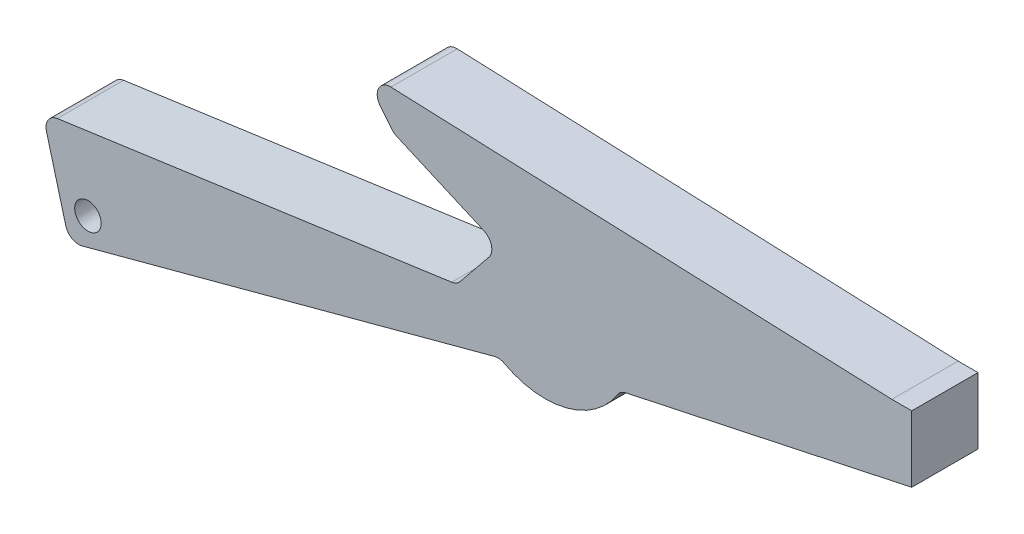
from build123d import *

# Parameters (mm, degrees)
BOSS_EXTRUDE1_DEPTH = 10
SKETCH2_R           = 2
CUT_EXTRUDE1_DEPTH  = 116.971936943
FILLET1_R           = 2


with BuildPart() as part:
    # Sketch1 → Boss-Extrude1 (new body)
    with BuildSketch(Plane(origin=(0, 0, 0), x_dir=(0, 1, 0), z_dir=(0, 0, 1))):
        with BuildLine():
            Line((-36.324229872, 27.68131099), (-51.324229872, 23.662073103))
            Line((-51.324229872, 23.662073103), (-33.907532364, -41.337926897))
            ThreePointArc((-33.907532364, -41.337926897), (-35.409341514, -51.440004773), (-29.149202114, -59.509581147))
            Line((-29.149202114, -59.509581147), (-19.739589339, -103.514798876))
            Line((-19.739589339, -103.514798876), (-9.739589339, -103.514798876))
            Line((-9.739589339, -103.514798876), (-9.739589339, -100.514798876))
            Line((-9.739589339, -100.514798876), (-6.545356821, -20.514798876))
            Line((-6.545356821, -20.514798876), (-12.545356821, -25.337926897))
            Line((-12.545356821, -25.337926897), (-19.535457388, -41.337926897))
            Line((-19.535457388, -41.337926897), (-27.535457388, -34.854054639))
            Line((-27.535457388, -34.854054639), (-36.324229872, 27.68131099))
        make_face()
    extrude(amount=BOSS_EXTRUDE1_DEPTH)

    # Sketch2 → Cut-Extrude1 (cut, through all)
    with BuildSketch(Plane.XY.offset(10)):
        with Locations((-20.833645978, -46.425250386)):
            Circle(SKETCH2_R)
    extrude(amount=-CUT_EXTRUDE1_DEPTH, mode=Mode.SUBTRACT)

    # Fillet1
    fillet1_edges = [part.edges().sort_by_distance(p)[0] for p in [
        (59.509581147, -29.149202114, 5),
        (41.337926897, -33.907532364, 5),
        (-23.662073103, -51.324229872, 5),
        (-27.68131099, -36.324229872, 5),
        (34.854054639, -27.535457388, 5),
        (41.337926897, -19.535457388, 5),
        (25.337926897, -12.545356821, 5),
        (20.514798876, -6.545356821, 5),
    ]]
    fillet(fillet1_edges, radius=FILLET1_R)


solid = part.part
